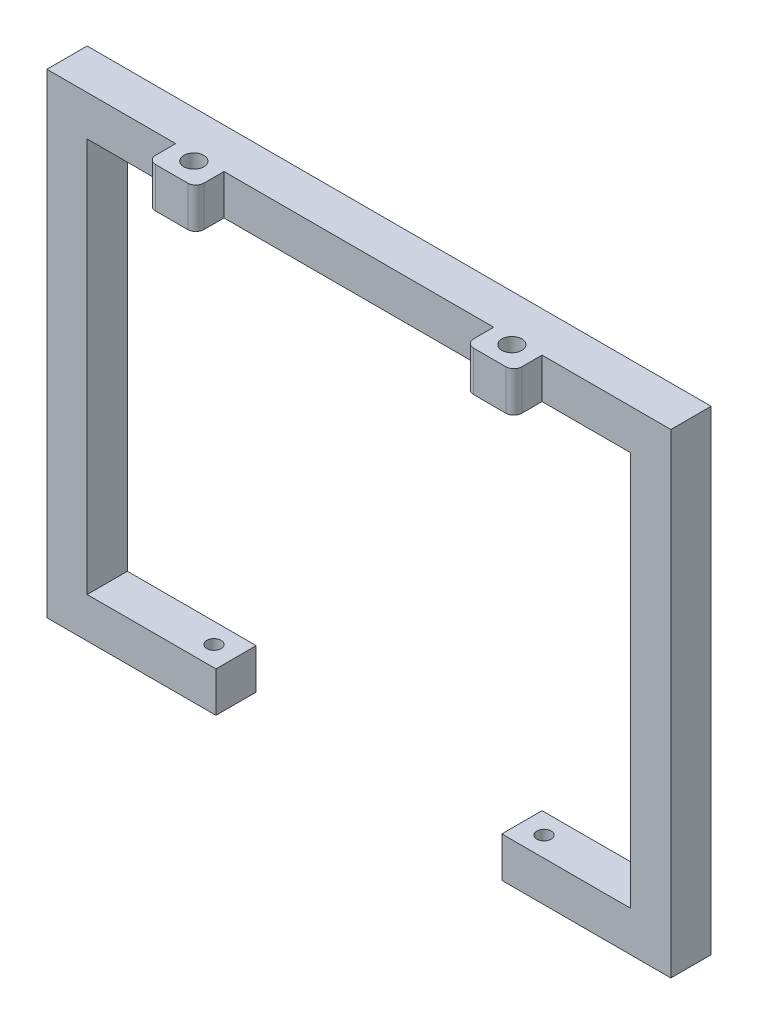
from build123d import *

# Parameters (mm, degrees)
BOSS_EXTRUDE1_DEPTH = 10
SKETCH3_R           = 1.775
CUT_EXTRUDE2_DEPTH  = 163.750712068
SKETCH4_W           = 12
SKETCH4_H           = 10
BOSS_EXTRUDE2_DEPTH = 7
SKETCH5_R           = 2.479798403
CUT_EXTRUDE3_DEPTH  = 10
FILLET1_R           = 2
FILLET2_R           = 2


with BuildPart() as part:
    # Sketch1 → Boss-Extrude1 (new body)
    with BuildSketch(Plane.XY):
        Polygon((-79.341642805, -34.372803322), (-79.341642805, -44.372803322), (-121.341642805, -44.372803322), (-121.341642805, 73.627196678), (33.658357195, 73.627196678), (33.658357195, -44.372803322), (-8.341642805, -44.372803322), (-8.341642805, -34.372803322), (23.658357195, -34.372803322), (23.658357195, 63.627196678), (-111.341642805, 63.627196678), (-111.341642805, -34.372803322), align=None)
    extrude(amount=BOSS_EXTRUDE1_DEPTH)

    # Sketch3 → Cut-Extrude2 (cut, through all)
    with BuildSketch(Plane(origin=(0, -34.372803322, 0), x_dir=(1, 0, 0), z_dir=(0, 1, 0))):
        with Locations(Location((-84.841642805, -5, 0), (0, 0, 270))):
            Circle(SKETCH3_R)
        with Locations(Location((-2.841642805, -5, 0), (0, 0, 270))):
            Circle(SKETCH3_R)
    extrude(amount=-CUT_EXTRUDE2_DEPTH, mode=Mode.SUBTRACT)

    # Sketch4 → Boss-Extrude2 (add)
    with BuildSketch(Plane.XY.offset(10)):
        with Locations((-83.341642805, 68.627196678)):
            Rectangle(SKETCH4_W, SKETCH4_H)
        with Locations((-4.341642805, 68.627196678)):
            Rectangle(SKETCH4_W, SKETCH4_H)
    extrude(amount=BOSS_EXTRUDE2_DEPTH)

    # Sketch5 → Cut-Extrude3 (cut)
    with BuildSketch(Plane(origin=(0, 73.627196678, 0), x_dir=(1, 0, 0), z_dir=(0, 1, 0))):
        with Locations(Location((-83.341642805, -11.5, 0), (0, 0, 270))):
            Circle(SKETCH5_R)
        with Locations(Location((-4.341642805, -11.5, 0), (0, 0, 270))):
            Circle(SKETCH5_R)
    extrude(amount=-CUT_EXTRUDE3_DEPTH, mode=Mode.SUBTRACT)

    # Fillet1
    fillet1_edges = [part.edges().sort_by_distance(p)[0] for p in [
        (-77.341642805, 68.627196678, 17),
        (-89.341642805, 68.627196678, 17),
    ]]
    fillet(fillet1_edges, radius=FILLET1_R)

    # Fillet2
    fillet2_edges = [part.edges().sort_by_distance(p)[0] for p in [
        (-10.341642805, 68.627196678, 17),
        (1.658357195, 68.627196678, 17),
    ]]
    fillet(fillet2_edges, radius=FILLET2_R)


solid = part.part
